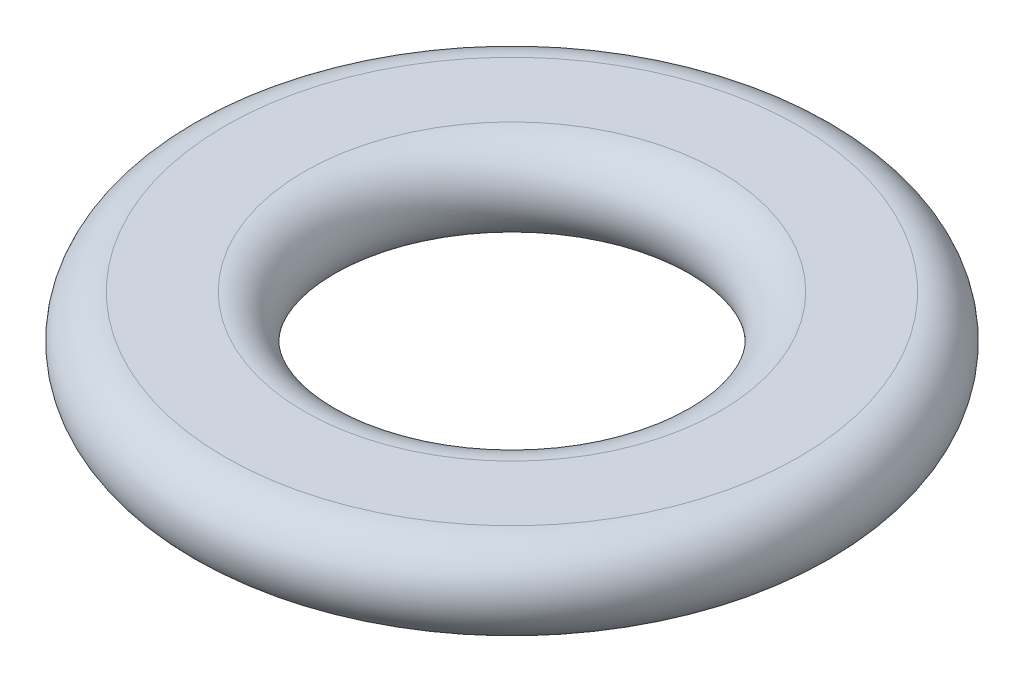
from build123d import *


with BuildPart() as part:
    # ProfileS → Profile (revolve)
    with BuildSketch(Plane.XY):
        with BuildLine():
            Line((3.15, 0.65), (4.35, 0.65))
            ThreePointArc((4.35, 0.65), (5, 0), (4.35, -0.65))
            Line((4.35, -0.65), (3.15, -0.65))
            ThreePointArc((3.15, -0.65), (2.5, 0), (3.15, 0.65))
        make_face()
    revolve(axis=Axis((0, 0.65, 0), (0, -1, 0)))


solid = part.part
